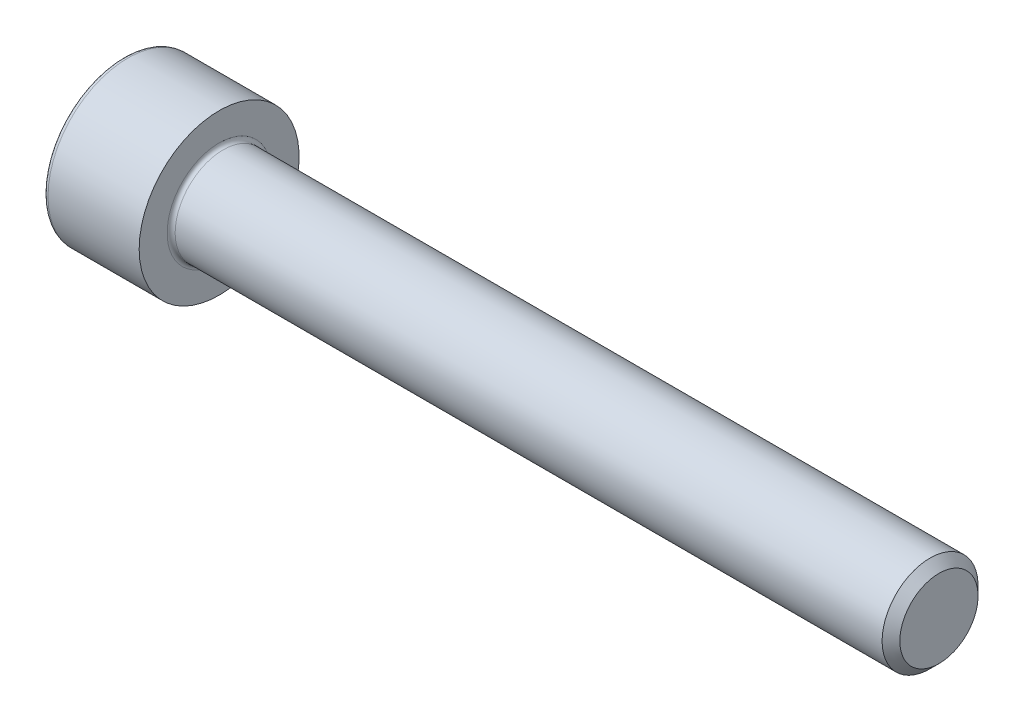
from build123d import *

# Parameters (mm, degrees)
FILLET1_R   = 0.25
FILLET2_R   = 0.3
HEX_2_DEPTH = 3


with BuildPart() as part:
    # BodySke → Base-Revolve (revolve)
    with BuildSketch(Plane.XY, mode=Mode.PRIVATE) as base_revolve_sk:
        Polygon((0, 0), (0, 5), (6, 5), (6, 3), (50.4455, 3), (51, 2.4455), (51, 0), align=None)
    revolve(base_revolve_sk.sketch.rotate(Axis((-31.75, 0, 0), (1, 0, 0)), 90), axis=Axis((-31.75, 0, 0), (1, 0, 0)))

    # Fillet1
    fillet1_edges = [part.edges().sort_by_distance(p)[0] for p in [
        (6, 0, -3),
    ]]
    fillet(fillet1_edges, radius=FILLET1_R)

    # Fillet2
    fillet2_edges = [part.edges().sort_by_distance(p)[0] for p in [
        (0, 0, -5),
    ]]
    fillet(fillet2_edges, radius=FILLET2_R)

    # Sketch2 → Hex-PreBroach (revolve, cut)
    with BuildSketch(Plane.XY, mode=Mode.PRIVATE) as hex_prebroach_sk:
        Polygon((0, 2.542), (3, 2.542), (4.467624384, 0), (0, 0), align=None)
    revolve(hex_prebroach_sk.sketch.rotate(Axis((0, 0, 0), (1, 0, 0)), 90), axis=Axis((0, 0, 0), (1, 0, 0)), mode=Mode.SUBTRACT)

    # Sketch3 → Hex 2 (cut)
    with BuildSketch(Plane(origin=(0, 0, 0), x_dir=(0, 0.500000000000001, 0.866025403784438), z_dir=(-1, 0, 0))):
        Polygon((1.467624384, 2.542), (-1.467624384, 2.542), (-2.935248769, 0), (-1.467624384, -2.542), (1.467624384, -2.542), (2.935248769, 0), align=None)
    extrude(amount=-HEX_2_DEPTH, mode=Mode.SUBTRACT)


solid = part.part
